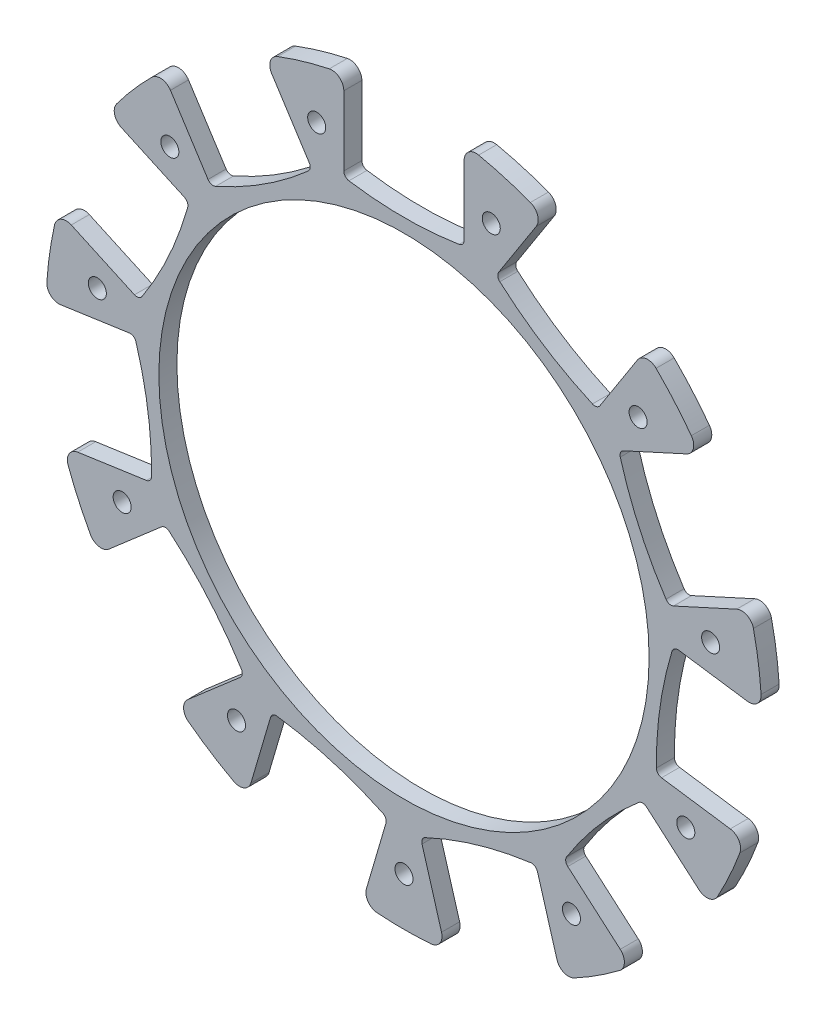
from build123d import *

# Parameters (mm, degrees)
SKETCH_2_R      = 40.75
SKETCH_2_R_2    = 1.5
EXTRUDE_1_DEPTH = 3
FILLET_1_R      = 1
FILLET_2_R      = 2


with BuildPart() as part:
    # 草图2 → 凸台-拉伸1 (new body)
    with BuildSketch(Plane.XY):
        with BuildLine():
            Line((10, 58.653644388), (10, 43.839202169))
            ThreePointArc((10, 43.839202169), (0, 43), (-10, 43.839202169))
            Line((-10, 43.839202169), (-10, 58.653644388))
            ThreePointArc((-10, 58.653644388), (-16.763087132, 57.08983193), (-23.29801892, 54.748993729))
            Line((-23.29801892, 54.748993729), (-15.288726769, 42.286291876))
            ThreePointArc((-15.288726769, 42.286291876), (-23.247555151, 36.173901912), (-32.113797426, 31.473475527))
            Line((-32.113797426, 31.473475527), (-40.123089577, 43.93617738))
            ThreePointArc((-40.123089577, 43.93617738), (-44.967099674, 38.96421367), (-49.199081449, 33.4619244))
            Line((-49.199081449, 33.4619244), (-35.723390814, 27.307782693))
            ThreePointArc((-35.723390814, 27.307782693), (-39.1141758, 17.862845559), (-44.031691074, 9.115142785))
            Line((-44.031691074, 9.115142785), (-57.50738171, 15.269284493))
            ThreePointArc((-57.50738171, 15.269284493), (-58.894375792, 8.467732877), (-59.479783242, 1.550930504))
            Line((-59.479783242, 1.550930504), (-44.816130685, 3.659245452))
            ThreePointArc((-44.816130685, 3.659245452), (-42.562322001, -6.119538046), (-41.969833919, -16.137183386))
            Line((-41.969833919, -16.137183386), (-56.633486477, -18.245498334))
            ThreePointArc((-56.633486477, -18.245498334), (-54.123103724, -24.717193274), (-50.87607412, -30.852472869))
            Line((-50.87607412, -30.852472869), (-39.680065719, -21.151076364))
            ThreePointArc((-39.680065719, -21.151076364), (-32.497231697, -28.15901156), (-26.58285104, -36.266067852))
            Line((-26.58285104, -36.266067852), (-37.778859441, -45.967464356))
            ThreePointArc((-37.778859441, -45.967464356), (-32.168128639, -50.054585203), (-26.119570938, -53.460434099))
            Line((-26.119570938, -53.460434099), (-21.945860253, -39.246080882))
            ThreePointArc((-21.945860253, -39.246080882), (-12.114499944, -41.258197865), (-2.756000781, -44.880732018))
            Line((-2.756000781, -44.880732018), (-6.929711465, -59.095085236))
            ThreePointArc((-6.929711465, -59.095085236), (0, -59.5), (6.929711465, -59.095085236))
            Line((6.929711465, -59.095085236), (2.756000781, -44.880732018))
            ThreePointArc((2.756000781, -44.880732018), (12.114499944, -41.258197865), (21.945860253, -39.246080882))
            Line((21.945860253, -39.246080882), (26.119570938, -53.460434099))
            ThreePointArc((26.119570938, -53.460434099), (32.168128639, -50.054585203), (37.778859441, -45.967464356))
            Line((37.778859441, -45.967464356), (26.58285104, -36.266067852))
            ThreePointArc((26.58285104, -36.266067852), (32.497231697, -28.15901156), (39.680065719, -21.151076364))
            Line((39.680065719, -21.151076364), (50.87607412, -30.852472869))
            ThreePointArc((50.87607412, -30.852472869), (54.123103724, -24.717193274), (56.633486477, -18.245498334))
            Line((56.633486477, -18.245498334), (41.969833919, -16.137183386))
            ThreePointArc((41.969833919, -16.137183386), (42.562322001, -6.119538046), (44.816130685, 3.659245452))
            Line((44.816130685, 3.659245452), (59.479783242, 1.550930504))
            ThreePointArc((59.479783242, 1.550930504), (58.894375792, 8.467732877), (57.50738171, 15.269284493))
            Line((57.50738171, 15.269284493), (44.031691074, 9.115142785))
            ThreePointArc((44.031691074, 9.115142785), (39.1141758, 17.862845559), (35.723390814, 27.307782693))
            Line((35.723390814, 27.307782693), (49.199081449, 33.4619244))
            ThreePointArc((49.199081449, 33.4619244), (44.967099674, 38.96421367), (40.123089577, 43.93617738))
            Line((40.123089577, 43.93617738), (32.113797426, 31.473475527))
            ThreePointArc((32.113797426, 31.473475527), (23.247555151, 36.173901912), (15.288726769, 42.286291876))
            Line((15.288726769, 42.286291876), (23.29801892, 54.748993729))
            ThreePointArc((23.29801892, 54.748993729), (16.763087132, 57.08983193), (10, 58.653644388))
        make_face()
        Circle(SKETCH_2_R, mode=Mode.SUBTRACT)
        with Locations((0, -51.5)):
            Circle(SKETCH_2_R_2, mode=Mode.SUBTRACT)
        with Locations((-27.843002099, -43.324556941)):
            Circle(SKETCH_2_R_2, mode=Mode.SUBTRACT)
        with Locations((-46.846047761, -21.39387317)):
            Circle(SKETCH_2_R_2, mode=Mode.SUBTRACT)
        with Locations((-50.975804257, 7.329214171)):
            Circle(SKETCH_2_R_2, mode=Mode.SUBTRACT)
        with Locations((-38.921103079, 33.725327798)):
            Circle(SKETCH_2_R_2, mode=Mode.SUBTRACT)
        with Locations((-14.509226677, 49.413888141)):
            Circle(SKETCH_2_R_2, mode=Mode.SUBTRACT)
        with Locations((14.509226677, 49.413888141)):
            Circle(SKETCH_2_R_2, mode=Mode.SUBTRACT)
        with Locations((38.921103079, 33.725327798)):
            Circle(SKETCH_2_R_2, mode=Mode.SUBTRACT)
        with Locations((50.975804257, 7.329214171)):
            Circle(SKETCH_2_R_2, mode=Mode.SUBTRACT)
        with Locations((46.846047761, -21.39387317)):
            Circle(SKETCH_2_R_2, mode=Mode.SUBTRACT)
        with Locations((27.843002099, -43.324556941)):
            Circle(SKETCH_2_R_2, mode=Mode.SUBTRACT)
    extrude(amount=EXTRUDE_1_DEPTH)

    # 圆角1
    fillet_1_edges = [part.edges().sort_by_distance(p)[0] for p in [
        (10, 43.839202169, 1.5),
        (-10, 43.839202169, 1.5),
        (-15.288726769, 42.286291876, 1.5),
        (-32.113797426, 31.473475527, 1.5),
        (-35.723390814, 27.307782693, 1.5),
        (-44.031691074, 9.115142785, 1.5),
        (-44.816130685, 3.659245452, 1.5),
        (-41.969833919, -16.137183386, 1.5),
        (-39.680065719, -21.151076364, 1.5),
        (-26.58285104, -36.266067852, 1.5),
        (-21.945860253, -39.246080882, 1.5),
        (-2.756000781, -44.880732018, 1.5),
        (2.756000781, -44.880732018, 1.5),
        (21.945860253, -39.246080882, 1.5),
        (26.58285104, -36.266067852, 1.5),
        (39.680065719, -21.151076364, 1.5),
        (41.969833919, -16.137183386, 1.5),
        (44.816130685, 3.659245452, 1.5),
        (44.031691074, 9.115142785, 1.5),
        (35.723390814, 27.307782693, 1.5),
        (32.113797426, 31.473475527, 1.5),
        (15.288726769, 42.286291876, 1.5),
    ]]
    fillet(fillet_1_edges, radius=FILLET_1_R)

    # 圆角2
    fillet_2_edges = [part.edges().sort_by_distance(p)[0] for p in [
        (10, 58.653644388, 1.5),
        (-10, 58.653644388, 1.5),
        (-23.29801892, 54.748993729, 1.5),
        (-40.123089577, 43.93617738, 1.5),
        (-49.199081449, 33.4619244, 1.5),
        (-57.50738171, 15.269284493, 1.5),
        (-59.479783242, 1.550930504, 1.5),
        (-56.633486477, -18.245498334, 1.5),
        (-50.87607412, -30.852472869, 1.5),
        (-37.778859441, -45.967464356, 1.5),
        (-26.119570938, -53.460434099, 1.5),
        (-6.929711465, -59.095085236, 1.5),
        (6.929711465, -59.095085236, 1.5),
        (26.119570938, -53.460434099, 1.5),
        (37.778859441, -45.967464356, 1.5),
        (50.87607412, -30.852472869, 1.5),
        (56.633486477, -18.245498334, 1.5),
        (59.479783242, 1.550930504, 1.5),
        (57.50738171, 15.269284493, 1.5),
        (49.199081449, 33.4619244, 1.5),
        (40.123089577, 43.93617738, 1.5),
        (23.29801892, 54.748993729, 1.5),
    ]]
    fillet(fillet_2_edges, radius=FILLET_2_R)


solid = part.part
